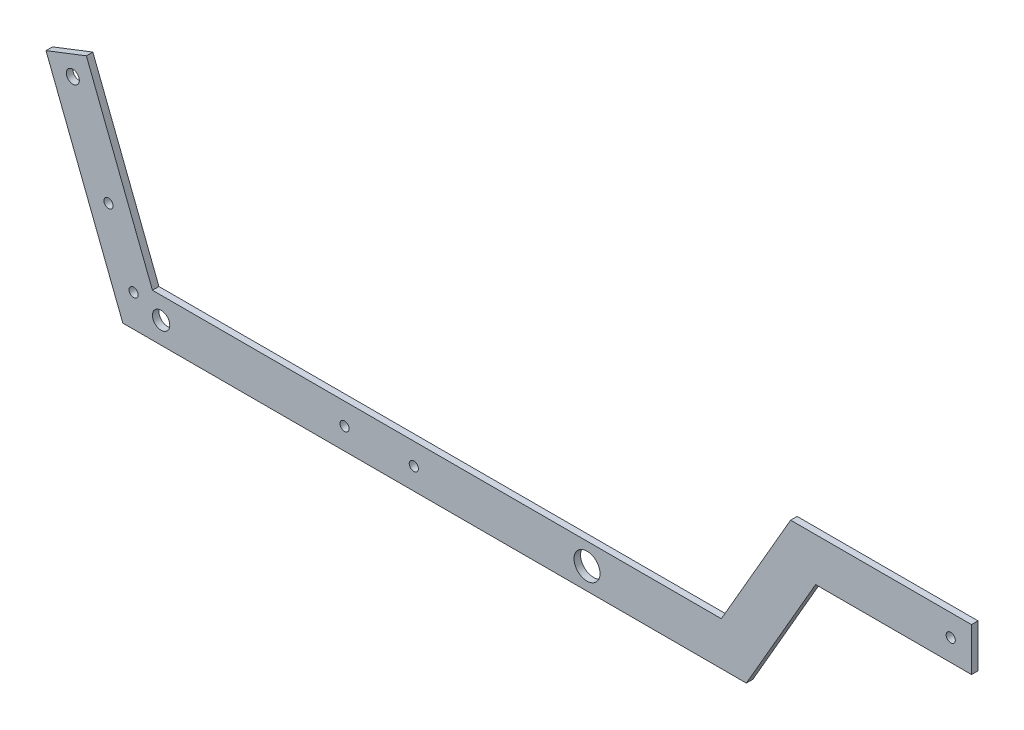
from build123d import *

# Parameters (mm, degrees)
SKETCH1_R           = 4.7625
BOSS_EXTRUDE1_DEPTH = 2.38125
SKETCH4_R           = 1.6764
SKETCH4_R_2         = 2.38125
CUT_EXTRUDE2_DEPTH  = 269.420180625
SKETCH5_R           = 1.6764
CUT_EXTRUDE3_DEPTH  = 269.420180625
SKETCH6_R           = 3.175
CUT_EXTRUDE4_DEPTH  = 269.420180625


with BuildPart() as part:
    # Sketch1 → Boss-Extrude1 (new body)
    with BuildSketch(Plane.XY):
        Polygon((0, 0), (25.4, 43.994090512), (82.55, 43.994090512), (82.55, 59.869090512), (16.234564477, 59.869090512), (-9.165435523, 15.875), (-217.739113558, 15.875), (-241.968881923, 78.201036741), (-256.765108354, 72.448879893), (-228.6, 0), align=None)
        with Locations(Location((-58.42, 7.9375, 0), (0, 0, 180))):
            Circle(SKETCH1_R, mode=Mode.SUBTRACT)
    extrude(amount=BOSS_EXTRUDE1_DEPTH)

    # Sketch4 → Cut-Extrude2 (cut, through all)
    with BuildSketch(Plane.XY.offset(2.38125)):
        with Locations((74.93, 51.931590512)):
            Circle(SKETCH4_R)
        with Locations((-246.937589356, 69.075817516)):
            Circle(SKETCH4_R_2)
    extrude(amount=-CUT_EXTRUDE2_DEPTH, mode=Mode.SUBTRACT)

    # Sketch5 → Cut-Extrude3 (cut, through all)
    with BuildSketch(Plane.XY.offset(2.38125)):
        with Locations((-147.32, 7.9375)):
            Circle(SKETCH5_R)
        with Locations((-121.92, 7.9375)):
            Circle(SKETCH5_R)
        with Locations((-224.653180894, 11.753814283)):
            Circle(SKETCH5_R)
        with Locations((-233.856631852, 35.427776572)):
            Circle(SKETCH5_R)
    extrude(amount=-CUT_EXTRUDE3_DEPTH, mode=Mode.SUBTRACT)

    # Sketch6 → Cut-Extrude4 (cut, through all)
    with BuildSketch(Plane.XY.offset(2.38125)):
        with Locations((-214.564113558, 7.9375)):
            Circle(SKETCH6_R)
    extrude(amount=-CUT_EXTRUDE4_DEPTH, mode=Mode.SUBTRACT)


solid = part.part
